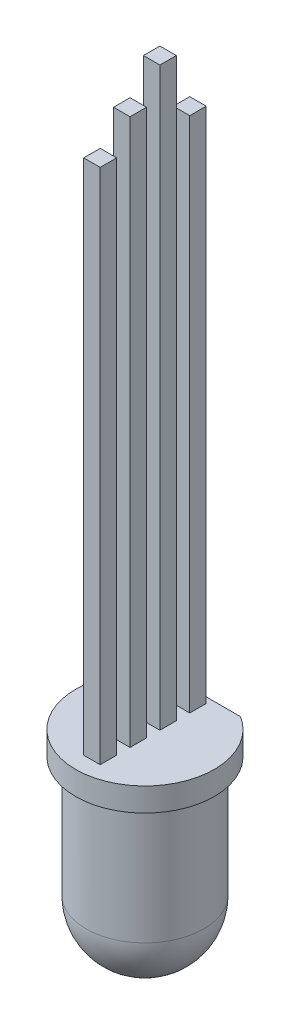
from build123d import *

# Parameters (mm, degrees)
ENL_V_MAT_EXTRU_1_REACH = 10.67
ESQUISSE3_W             = 0.7
ESQUISSE3_H             = 0.7
BOSS_EXTRU_1_DEPTH      = 24.5
ENL_V_START             = -3.3
ENL_V_MAT_EXTRU_2_DEPTH = 5.9


with BuildPart() as part:
    # Esquisse1 → Révolution1 (revolve)
    with BuildSketch(Plane.XY):
        with BuildLine():
            Line((2.5, 7.6), (2.5, 2.5))
            ThreePointArc((2.5, 2.5), (1.767766953, 0.732233047), (0, 0))
            Line((0, 0), (0, 8.6))
            Line((0, 8.6), (2.95, 8.6))
            Line((2.95, 8.6), (2.95, 7.6))
            Line((2.95, 7.6), (2.5, 7.6))
        make_face()
    revolve(axis=Axis((0, 0, 0), (0, 1, 0)))

    # Esquisse2 → Enlèv. mat.-Extru.1 (cut, up to next)
    with BuildSketch(Plane(origin=(0, 7.6, 0), x_dir=(-1, 0, 0), z_dir=(0, -1, 0)), mode=Mode.PRIVATE) as enl_v_mat_extru_1_sk1:
        Polygon((2.031643218, 2.5), (-2.119175806, 2.5), (-0.304277426, 5.41579693), align=None)
    enl_v_mat_extru_1_tool1 = extrude(enl_v_mat_extru_1_sk1.sketch, amount=-ENL_V_MAT_EXTRU_1_REACH, mode=Mode.PRIVATE) & part.part
    add(enl_v_mat_extru_1_tool1.solids().sort_by_distance((0.130603, 7.6, -3.471932))[0], mode=Mode.SUBTRACT)

    # Esquisse3 → Boss.-Extru.1 (add)
    with BuildSketch(Plane(origin=(0, 8.6, 0), x_dir=(1, 0, 0), z_dir=(0, 1, 0))):
        with Locations((0, 1.905)):
            Rectangle(ESQUISSE3_W, ESQUISSE3_H)
        with Locations((0, -0.635)):
            Rectangle(ESQUISSE3_W, ESQUISSE3_H)
        with Locations((0, -1.905)):
            Rectangle(ESQUISSE3_W, ESQUISSE3_H)
        with Locations((0, 0.635)):
            Rectangle(ESQUISSE3_W, ESQUISSE3_H)
    extrude(amount=BOSS_EXTRU_1_DEPTH)

    # Esquisse4 → Enlèv. mat.-Extru.2 (cut)
    with BuildSketch(Plane.ZY.offset(0.35).offset(ENL_V_START)):
        Polygon((-2.885095567, 30.6), (-1.265657514, 30.6), (-1.265657514, 33.921907916), (0, 33.921907916), (0, 31.83), (1.344412991, 31.83), (1.344412991, 30.6), (2.897512796, 30.6), (2.897512796, 34.676886987), (-2.885095567, 34.676886987), align=None)
    extrude(amount=ENL_V_MAT_EXTRU_2_DEPTH, mode=Mode.SUBTRACT)


solid = part.part
